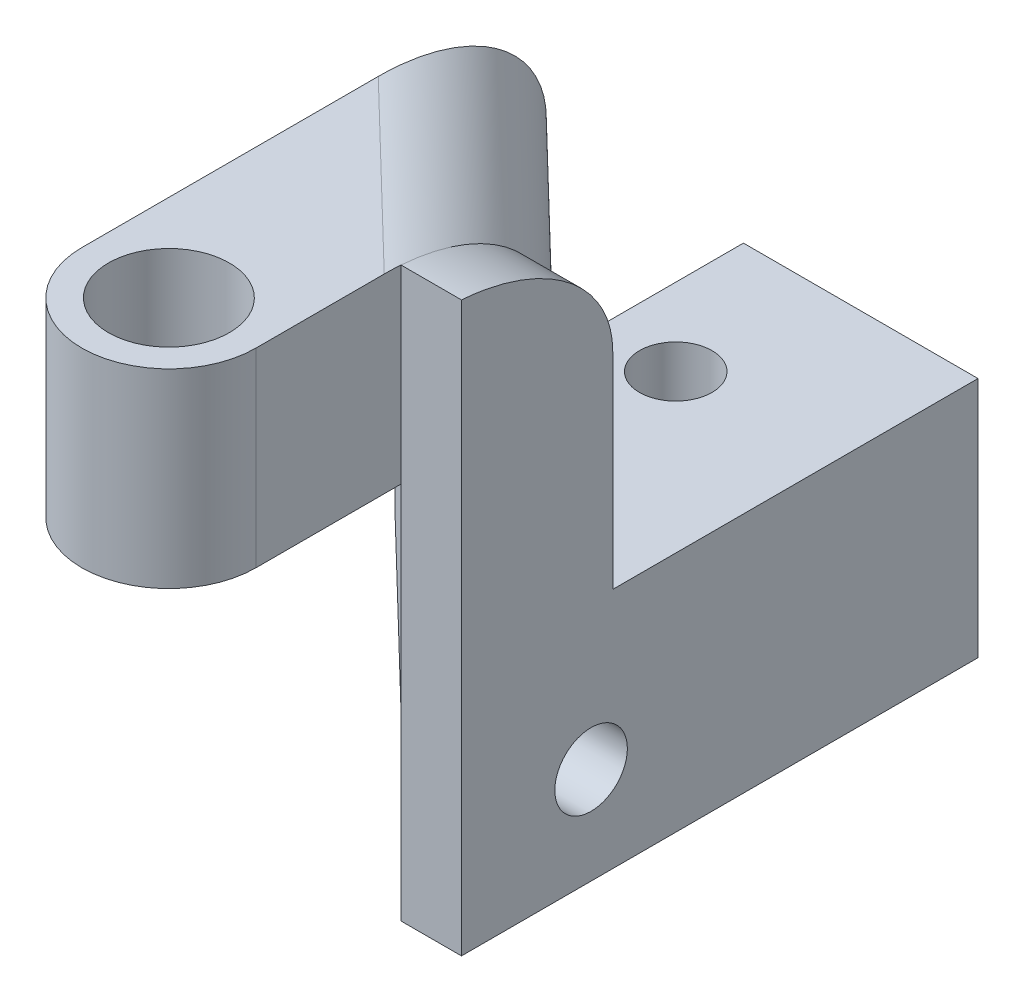
from build123d import *

# Parameters (mm, degrees)
CROQUIS1_R              = 1.5
SALIENTE_EXTRUIR1_DEPTH = 2.5
SALIENTE_EXTRUIR2_START = 8.15
CROQUIS1_3_R            = 2.5
SALIENTE_EXTRUIR2_DEPTH = 7.87
SALIENTE_EXTRUIR5_DEPTH = 16.02
REDONDEO3_R             = 5
CROQUIS8_W              = 21.36
CROQUIS8_H              = 7.5
CROQUIS8_R              = 1.5
SALIENTE_EXTRUIR6_DEPTH = 2.5


with BuildPart() as part:
    # Croquis1 → Saliente-Extruir1 (new body)
    with BuildSketch(Plane(origin=(0, 0, 0), x_dir=(1, 0, 0), z_dir=(0, 1, 0))):
        Polygon((3.6, 27.36), (-3.6, 27.36), (-3.6, 12.952959179), (3.6, 6), align=None)
        with Locations(Location((-0.4, 21.36, 0), (0, 0, 270))):
            Circle(CROQUIS1_R, mode=Mode.SUBTRACT)
    extrude(amount=SALIENTE_EXTRUIR1_DEPTH)



with BuildPart() as body_2:
    # Croquis1<3> → Saliente-Extruir2 (new body)
    with BuildSketch(Plane(origin=(0, 0, 0), x_dir=(1, 0, 0), z_dir=(0, 1, 0)).offset(SALIENTE_EXTRUIR2_START)):
        with BuildLine():
            Line((3.6, 6), (-3.6, 12.952959179))
            Line((-3.6, 12.952959179), (-3.6, 0))
            ThreePointArc((-3.6, 0), (0, -3.6), (3.6, 0))
            Line((3.6, 0), (3.6, 6))
        make_face()
        with Locations(Location((0, 0, 0), (0, 0, 270))):
            Circle(CROQUIS1_3_R, mode=Mode.SUBTRACT)
    extrude(amount=SALIENTE_EXTRUIR2_DEPTH)


with BuildPart() as part_1:
    add(part.part)

    add(body_2.part)  # Saliente-Extruir5 merges body 2
    # Croquis1<6> → Saliente-Extruir5 (add)
    with BuildSketch(Plane(origin=(0, 0, 0), x_dir=(1, 0, 0), z_dir=(0, 1, 0))):
        Polygon((3.6, 12.25573616), (-3.6, 19.208695338), (-3.6, 12.952959179), (3.6, 6), align=None)
    extrude(amount=SALIENTE_EXTRUIR5_DEPTH)

    # Redondeo3
    redondeo3_edges = [part_1.edges().sort_by_distance(p)[0] for p in [
        (0, 16.02, -15.732215749),
    ]]
    fillet(redondeo3_edges, radius=REDONDEO3_R)

    # Croquis8 → Saliente-Extruir6 (add)
    # profile 1 of 2: a face of its own
    with BuildSketch(Plane(origin=(3.6, 0, 0), x_dir=(0, 0, -1), z_dir=(1, 0, 0))):
        with BuildLine():
            Line((6, 15.994937186), (6, 8.15))
            Line((6, 8.15), (6, 0))
            Line((6, 0), (27.36, 0))
            Line((27.36, 0), (27.36, 2.5))
            Line((27.36, 2.5), (12.25573616, 2.5))
            Line((12.25573616, 2.5), (12.25573616, 11.02))
            add(Edge.make_bspline(
                [(12.25573616, 11.02), (12.25573616, 15.542670169), (6, 15.994937186)],
                knots=[0, 0, 0, 1.461710102, 1.461710102, 1.461710102], degree=2, weights=[1, 0.727447175, 0.962144349]))
        make_face()
    # profile 2 of 2: a face of its own
    with BuildSketch(Plane(origin=(3.6, 0, 0), x_dir=(0, 0, -1), z_dir=(1, 0, 0))):
        with Locations((16.68, -3.75)):
            Rectangle(CROQUIS8_W, CROQUIS8_H)
        with Locations((11.36, -3.5)):
            Circle(CROQUIS8_R, mode=Mode.SUBTRACT)
    extrude(amount=SALIENTE_EXTRUIR6_DEPTH)


solid = part_1.part
